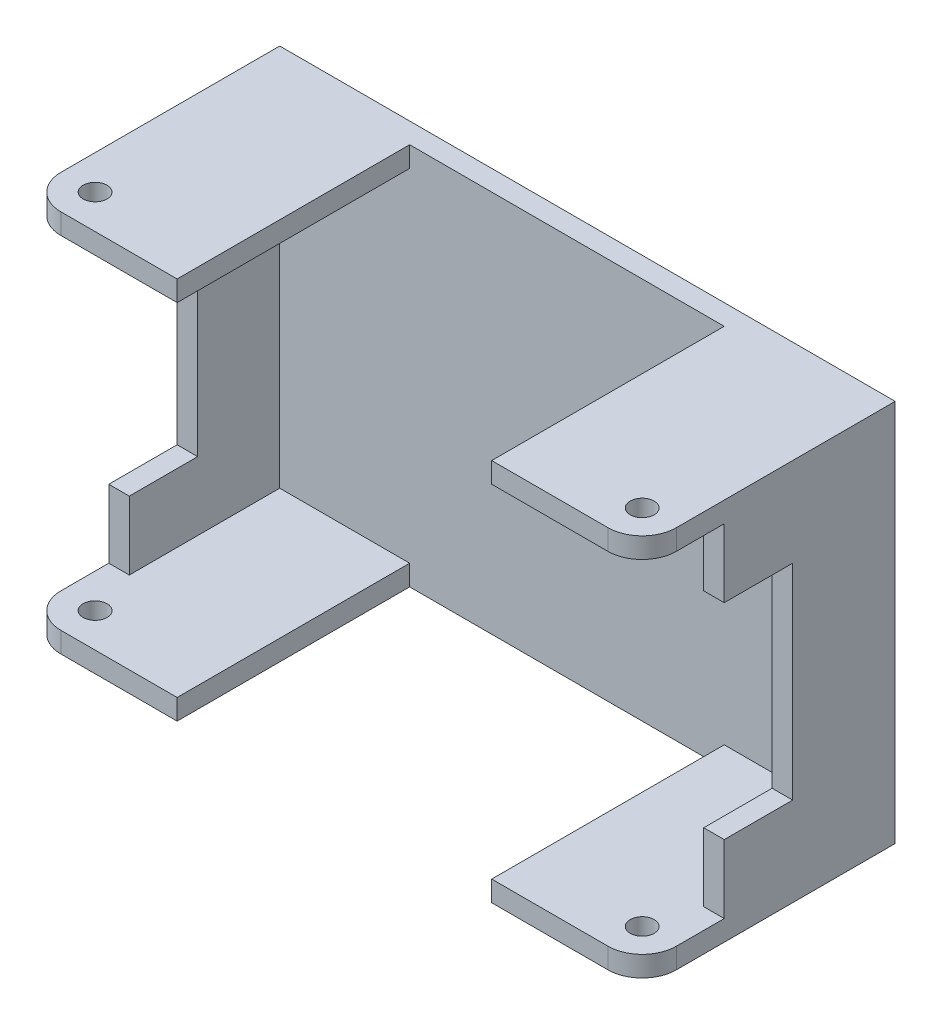
from build123d import *

# Parameters (mm, degrees)
SZKIC1_W                    = 90
SZKIC1_H                    = 56
DODANIE_WYCI_GNI_CIE1_DEPTH = 3
SZKIC2_W                    = 90
SZKIC2_H                    = 3
DODANIE_WYCI_GNI_CIE2_DEPTH = 34
SZKIC4_R                    = 1.75
WYTNIJ_WYCI_GNI_CIE1_DEPTH  = 81.808415403
ZAOKR_GLENIE1_R             = 5
SZKIC5_W                    = 46
SZKIC5_H                    = 40
WYTNIJ_WYCI_GNI_CIE2_DEPTH  = 81.808415403
SZKIC6_W                    = 3
SZKIC6_H                    = 50
DODANIE_WYCI_GNI_CIE4_DEPTH = 12
SZKIC7_W                    = 3
SZKIC7_H                    = 10
DODANIE_WYCI_GNI_CIE5_DEPTH = 10


with BuildPart() as part:
    # Szkic1 → Dodanie-wyciągnięcie1 (new body)
    with BuildSketch(Plane.XY):
        Rectangle(SZKIC1_W, SZKIC1_H)
    extrude(amount=DODANIE_WYCI_GNI_CIE1_DEPTH)

    # Szkic2 → Dodanie-wyciągnięcie2 (add)
    with BuildSketch(Plane.XY.offset(3)):
        with Locations((0, 26.5)):
            Rectangle(SZKIC2_W, SZKIC2_H)
        with Locations((0, -26.5)):
            Rectangle(SZKIC2_W, SZKIC2_H)
    extrude(amount=DODANIE_WYCI_GNI_CIE2_DEPTH)

    # Szkic4 → Wytnij-wyciągnięcie1 (cut, through all)
    with BuildSketch(Plane(origin=(0, 28, 0), x_dir=(1, 0, 0), z_dir=(0, 1, 0))):
        with Locations(Location((-40, -32, 0), (0, 0, 270))):
            Circle(SZKIC4_R)
        with Locations(Location((40, -32, 0), (0, 0, 270))):
            Circle(SZKIC4_R)
    extrude(amount=-WYTNIJ_WYCI_GNI_CIE1_DEPTH, mode=Mode.SUBTRACT)

    # Zaokrąglenie1
    zaokr_glenie1_edges = [part.edges().sort_by_distance(p)[0] for p in [
        (-45, 26.5, 37),
        (45, 26.5, 37),
        (45, -26.5, 37),
        (-45, -26.5, 37),
    ]]
    fillet(zaokr_glenie1_edges, radius=ZAOKR_GLENIE1_R)

    # Szkic5 → Wytnij-wyciągnięcie2 (cut, through all)
    with BuildSketch(Plane(origin=(0, 28, 0), x_dir=(1, 0, 0), z_dir=(0, 1, 0))):
        with Locations((0, -23)):
            Rectangle(SZKIC5_W, SZKIC5_H)
    extrude(amount=-WYTNIJ_WYCI_GNI_CIE2_DEPTH, mode=Mode.SUBTRACT)

    # Szkic6 → Dodanie-wyciągnięcie4 (add)
    with BuildSketch(Plane.XY.offset(3)):
        with Locations((-43.5, 0)):
            Rectangle(SZKIC6_W, SZKIC6_H)
        with Locations((43.5, 0)):
            Rectangle(SZKIC6_W, SZKIC6_H)
    extrude(amount=DODANIE_WYCI_GNI_CIE4_DEPTH)

    # Szkic7 → Dodanie-wyciągnięcie5 (add)
    with BuildSketch(Plane.XY.offset(15)):
        with Locations((-43.5, 20)):
            Rectangle(SZKIC7_W, SZKIC7_H)
        with Locations((-43.5, -20)):
            Rectangle(SZKIC7_W, SZKIC7_H)
        with Locations((43.5, -20)):
            Rectangle(SZKIC7_W, SZKIC7_H)
        with Locations((43.5, 20)):
            Rectangle(SZKIC7_W, SZKIC7_H)
    extrude(amount=DODANIE_WYCI_GNI_CIE5_DEPTH)


solid = part.part
